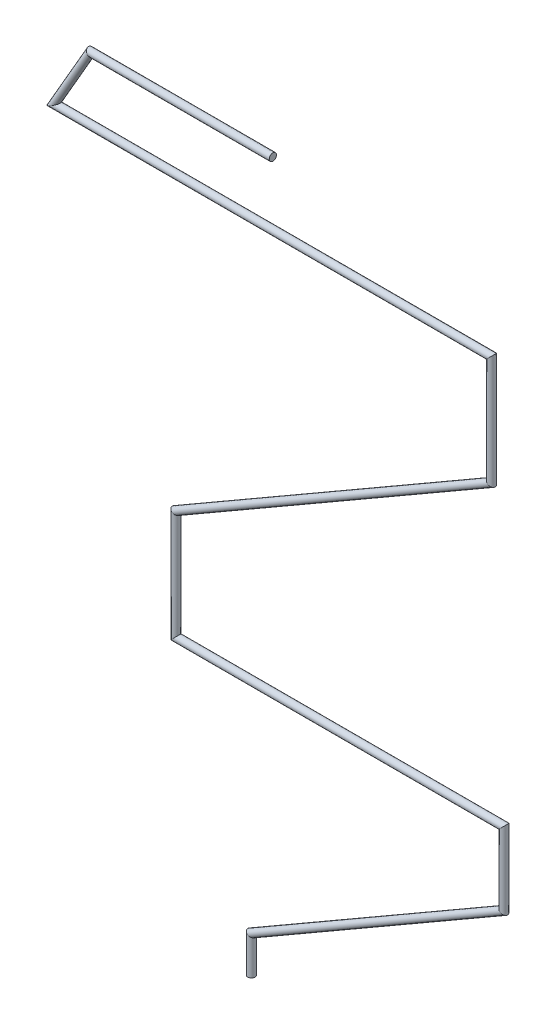
from build123d import *

# Parameters (mm, degrees)
SWEEP1_PROFILE_R = 0.5


with BuildPart() as part:
    # Sweep1: sweep along a path in Schizzo39
    with BuildLine(Plane.XY) as sweep1_path:
        Line((0, 0), (0, 5))
        Line((0, 5), (34.641016151, 25))
        Line((34.641016151, 25), (34.641016151, 35))
        Line((34.641016151, 35), (-10.358983849, 35))
        Line((-10.358983849, 35), (-10.358983849, 50))
        Line((-10.358983849, 50), (32.942286341, 75))
        Line((32.942286341, 75), (32.942286341, 90))
        Line((32.942286341, 90), (-27.057713659, 90))
        Line((-27.057713659, 90), (-22.057713659, 98.660254038))
        Line((-22.057713659, 98.660254038), (2.942286341, 98.660254038))
    # Sweep1 profile (on start of the path) → Sweep1 (sweep)
    with BuildSketch(Plane.ZX):
        Circle(SWEEP1_PROFILE_R)
    sweep(path=sweep1_path.line, transition=Transition.RIGHT)


solid = part.part
